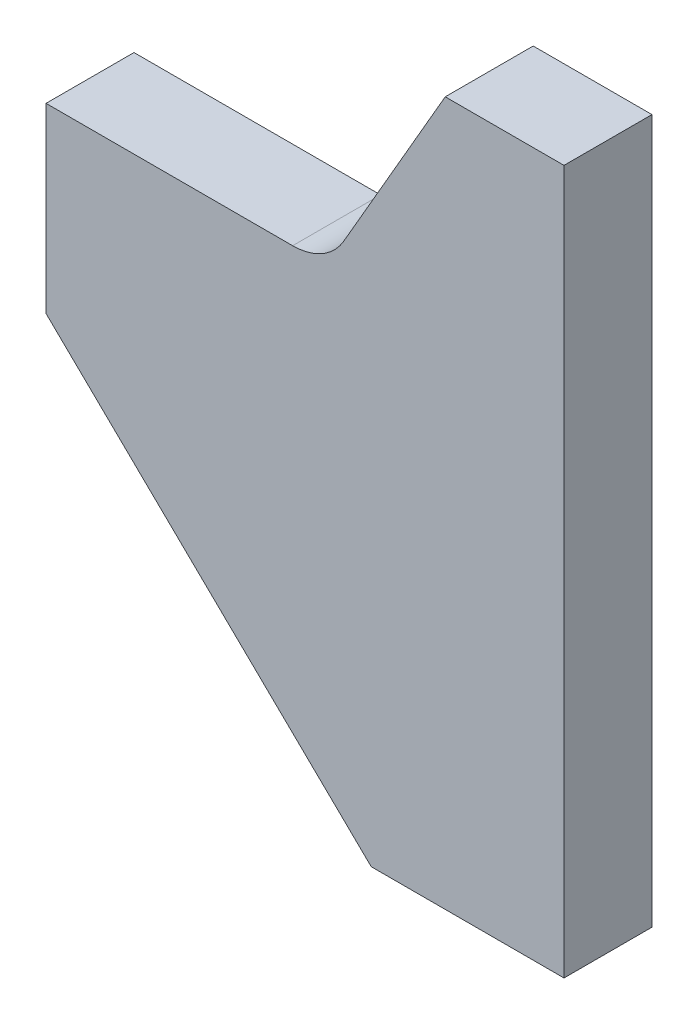
from build123d import *

# Parameters (mm, degrees)
BOSS_EXTRUDE1_DEPTH = 3


with BuildPart() as part:
    # Sketch1 → Boss-Extrude1 (new body)
    with BuildSketch(Plane.XY):
        with BuildLine():
            Line((79.925008739, 13.169583611), (86.5, 13.169583611))
            Line((86.5, 13.169583611), (86.5, 37.169583611))
            Line((86.5, 37.169583611), (82.449961477, 37.169583611))
            Line((82.449961477, 37.169583611), (78.989723206, 31.17627512))
            ThreePointArc((78.989723206, 31.17627512), (78.252773874, 30.439325787), (77.246082365, 30.169583611))
            Line((77.246082365, 30.169583611), (68.83616957, 30.169583611))
            Line((68.83616957, 30.169583611), (68.83616957, 23.962023793))
            Line((68.83616957, 23.962023793), (79.925008739, 13.169583611))
        make_face()
    extrude(amount=BOSS_EXTRUDE1_DEPTH)


solid = part.part
